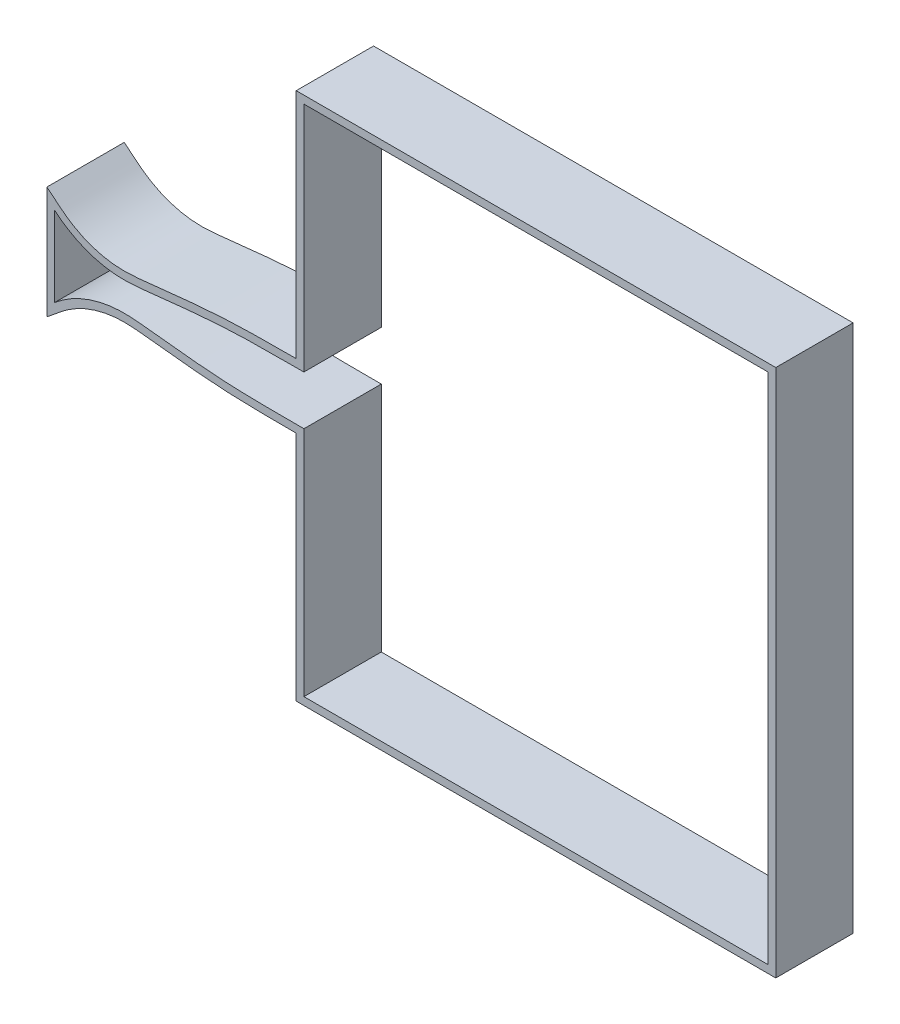
from build123d import *

# Parameters (mm, degrees)
BOSS_EXTRUDE1_DEPTH = 10


with BuildPart() as part:
    # Sketch1 → Boss-Extrude1 (new body)
    with BuildSketch(Plane.XY):
        with BuildLine():
            Line((22.239488, 4.172871951), (22.239488, 34.175))
            Line((22.239488, 34.175), (84.239488, 34.175))
            Line((84.239488, 34.175), (84.239488, -34.175))
            Line((84.239488, -34.175), (22.239488, -34.175))
            Line((22.239488, -34.175), (22.239488, -4.172871951))
            add(Edge.make_bspline(
                [(22.239488, -4.172871951), (20.811936237, -4.16995243), (17.963311559, -4.167994042), (13.651754932, -4.068671657), (9.331479031, -3.767364838), (5.784640978, -3.369979917), (2.95109285, -3.070473951), (0.846895558, -2.84551462), (-1.117705925, -2.848890085), (-3.084740909, -3.177332136), (-4.971804576, -3.798295309), (-6.449840697, -4.553316639), (-7.410297413, -5.193382202), (-7.94471134, -5.593586015), (-8.252225011, -5.847578902), (-8.548354976, -6.089216355), (-8.819451895, -6.310186739), (-9.305605744, -6.706572599), (-9.718285875, -7.043010414), (-9.9943, -7.2680404)],
                knots=[-0.063648949, -0.063648949, -0.063648949, -0.063648949, 0.065536167, 0.194721282, 0.323906398, 0.453091514, 0.517684072, 0.58227663, 0.646869188, 0.711461746, 0.776054304, 0.840646861, 0.87294314, 0.88909128, 0.905239419, 0.913313489, 0.921387559, 0.937535698, 0.969831977, 0.969831977, 0.969831977, 0.969831977], degree=3))
            Line((-9.9943, -7.2680404), (-9.9943, 7.2680404))
            add(Edge.make_bspline(
                [(-9.9943, 7.2680404), (-9.718285875, 7.043010414), (-9.305605744, 6.706572599), (-8.819451895, 6.310186739), (-8.548354976, 6.089216355), (-8.252225011, 5.847578902), (-7.94471134, 5.593586015), (-7.410297413, 5.193382202), (-6.449840697, 4.553316639), (-4.971804576, 3.798295309), (-3.084740909, 3.177332136), (-1.117705925, 2.848890085), (0.846895558, 2.84551462), (2.95109285, 3.070473951), (5.784640978, 3.369979917), (9.331479031, 3.767364838), (13.651754932, 4.068671657), (17.963311559, 4.167994042), (20.811936237, 4.16995243), (22.239488, 4.172871951)],
                knots=[-0.063648949, -0.063648949, -0.063648949, -0.063648949, -0.03135267, -0.015204531, -0.007130461, 0.000943609, 0.017091748, 0.033239888, 0.065536167, 0.130128725, 0.194721282, 0.25931384, 0.323906398, 0.388498956, 0.453091514, 0.58227663, 0.711461746, 0.840646861, 0.969831977, 0.969831977, 0.969831977, 0.969831977], degree=3))
        make_face()
        with BuildLine():
            Line((-8.9943, 5.162528), (-8.9943, -5.162528))
            add(Edge.make_bspline(
                [(-8.9943, -5.162528), (-8.992203206, -5.160818517), (-8.98586262, -5.155649136), (-8.971129638, -5.143403342), (-8.941596507, -5.118788275), (-8.889795396, -5.075674298), (-8.819707257, -5.017872266), (-8.739535444, -4.952719339), (-8.658924661, -4.888049496), (-8.577791761, -4.823999043), (-8.496258263, -4.760453941), (-8.414205967, -4.697584415), (-8.331736552, -4.635254146), (-8.248777214, -4.573563059), (-8.165419061, -4.512434699), (-8.081580077, -4.45196728), (-7.9973532, -4.392059705), (-7.912646922, -4.332839746), (-7.827516389, -4.274244032), (-7.741952356, -4.216312216), (-7.656032011, -4.158921328), (-7.5696025, -4.102309097), (-7.482848419, -4.046222466), (-7.366578831, -3.972380582), (-7.249521601, -3.899846958), (-7.10222116, -3.810815104), (-6.98360377, -3.740946897), (-6.864263465, -3.672349055), (-6.774351679, -3.621638171), (-6.684136735, -3.571491967), (-6.593487596, -3.522132873), (-6.502506407, -3.473416905), (-6.380762357, -3.409328633), (-6.258312716, -3.346634834), (-6.135165576, -3.285356586), (-6.042502537, -3.240030779), (-5.949500015, -3.195440637), (-5.856205076, -3.151484582), (-5.76254452, -3.108366232), (-5.637330863, -3.051619351), (-5.511439039, -2.996407964), (-5.384988859, -2.942495224), (-5.289848788, -2.90280669), (-5.194408906, -2.863895372), (-5.098733929, -2.825565756), (-5.002756597, -2.788053796), (-4.906520294, -2.751229744), (-4.810020655, -2.71512666), (-4.713276293, -2.679705658), (-4.616236394, -2.645096525), (-4.519008245, -2.611100866), (-4.421484056, -2.577920992), (-4.32374684, -2.545422054), (-4.225759333, -2.513688605), (-4.127585288, -2.48259141), (-4.02916043, -2.452366366), (-3.93056407, -2.422738024), (-3.831719131, -2.393979651), (-3.73268439, -2.365861036), (-3.633432171, -2.338510442), (-3.533997518, -2.311878394), (-3.434363987, -2.286066253), (-3.334575625, -2.260904143), (-3.234603794, -2.236500302), (-3.1344442, -2.212891407), (-3.034127127, -2.190005598), (-2.933644312, -2.16786689), (-2.833016004, -2.146456177), (-2.73222849, -2.125841282), (-2.631307918, -2.105959485), (-2.530249774, -2.086820843), (-2.429061322, -2.068396827), (-2.327736643, -2.050800997), (-2.22630246, -2.033892869), (-2.12474757, -2.017804859), (-2.02307448, -2.002439883), (-1.921294105, -1.987809674), (-1.819415258, -1.973964347), (-1.717451354, -1.960910941), (-1.615408345, -1.948587767), (-1.513272589, -1.936985969), (-1.411047623, -1.926204243), (-1.308761012, -1.916125148), (-1.206416776, -1.906838844), (-1.10400139, -1.898348903), (-1.001535686, -1.890570128), (-0.899011185, -1.88360275), (-0.796463235, -1.877341897), (-0.693870688, -1.871896688), (-0.591253692, -1.867155595), (-0.488607835, -1.863214354), (-0.385933935, -1.860064903), (-0.283247852, -1.857623052), (-0.180531822, -1.855997245), (-0.077816037, -1.85508318), (0.024884574, -1.854942505), (0.12755585, -1.855680532), (0.230213339, -1.85705765), (0.332872854, -1.859193557), (0.435517245, -1.862089014), (0.538137151, -1.865625069), (0.640720548, -1.870023623), (0.743276429, -1.874780017), (0.845801317, -1.880432492), (0.948301748, -1.886352868), (1.050773913, -1.892989226), (1.153211127, -1.899969072), (1.255624107, -1.907306406), (1.358002973, -1.915101749), (1.46037415, -1.923173585), (1.562722462, -1.93164289), (1.665059294, -1.940210628), (1.767349607, -1.94923381), (1.869643143, -1.958309398), (1.971911547, -1.967704888), (2.07417101, -1.977234639), (2.176406711, -1.986906275), (2.278616518, -1.996854456), (2.380827933, -2.006795529), (2.483026454, -2.016977436), (2.585234764, -2.02718377), (2.721482878, -2.041004503), (2.857716127, -2.054960241), (2.993925547, -2.069106268), (3.096089226, -2.079745833), (3.198242005, -2.090410655), (3.300388701, -2.101191252), (3.436578964, -2.115600076), (3.572774714, -2.130001449), (3.708958822, -2.144536798), (3.811095708, -2.155417601), (3.913234355, -2.166292493), (4.015367322, -2.17723734), (4.117504518, -2.188153155), (4.219639884, -2.19908919), (4.32177904, -2.210000413), (4.457948535, -2.224653433), (4.594136158, -2.239150992), (4.730303873, -2.253823725), (4.832447905, -2.264706237), (4.934576704, -2.275717192), (5.036719722, -2.286606382), (5.138849282, -2.297610582), (5.240992277, -2.308499985), (5.343121168, -2.319510089), (5.445264527, -2.330395756), (5.547396695, -2.341388952), (5.649520606, -2.352345348), (5.751652944, -2.363336952), (5.853796019, -2.37422839), (5.989982034, -2.388882119), (6.126160723, -2.403490373), (6.262337286, -2.418118778), (6.364473405, -2.429085993), (6.466606851, -2.440067603), (6.568749044, -2.450964159), (6.670878566, -2.461968374), (6.773019049, -2.472870325), (6.875168231, -2.483804949), (6.977302168, -2.494740746), (7.079455082, -2.505609954), (7.18158511, -2.516528009), (7.283743863, -2.527287031), (7.385884966, -2.538174726), (7.488051977, -2.548919623), (7.590218317, -2.559629437), (7.69237632, -2.570377952), (7.794556884, -2.581000171), (7.896731641, -2.59161017), (7.998924778, -2.602119663), (8.101102412, -2.612588839), (8.203290439, -2.623038473), (8.305481566, -2.633389343), (8.407703269, -2.643642556), (8.509916144, -2.653898932), (8.612153553, -2.66397771), (8.714382571, -2.674058828), (8.816629453, -2.68403213), (8.918872297, -2.693948187), (9.021120802, -2.703709794), (9.157469743, -2.716646149), (9.293839908, -2.729396843), (9.430224982, -2.742006878), (9.532524926, -2.751336831), (9.634828516, -2.76051644), (9.737139421, -2.769661208), (9.839470537, -2.778636437), (9.941809604, -2.787567275), (10.044167889, -2.796338059), (10.146504315, -2.805082209), (10.248867356, -2.813576388), (10.351228456, -2.822134759), (10.453617082, -2.830429571), (10.556010143, -2.838713585), (10.658407431, -2.846836333), (10.760816939, -2.854853891), (10.897375037, -2.865350629), (11.03392921, -2.875736931), (11.204661852, -2.888229806), (11.341260343, -2.898115843), (11.477878204, -2.90777299), (11.580360741, -2.914810964), (11.682836949, -2.921817544), (11.78533197, -2.928652095), (11.887819832, -2.935466787), (11.990316563, -2.94204092), (12.09281819, -2.948615295), (12.19534351, -2.954934101), (12.297859492, -2.961287536), (12.400391171, -2.967506261), (12.502928266, -2.973509673), (12.605473012, -2.979491982), (12.708008371, -2.985304473), (12.810553712, -2.991072136), (12.913114846, -2.996699097), (13.015690838, -3.002187265), (13.118263381, -3.007630968), (13.220839727, -3.012905925), (13.32341104, -3.018156681), (13.425988594, -3.023180174), (13.528576417, -3.028154709), (13.63117684, -3.033056896), (13.733780089, -3.037802969), (13.836380399, -3.04250297), (13.938982519, -3.047062038), (14.041599171, -3.051482873), (14.144213518, -3.055855903), (14.24683007, -3.060072986), (14.349459564, -3.064218205), (14.452086314, -3.068317114), (14.554732764, -3.072171988), (14.657359343, -3.076071303), (14.760003774, -3.079785757), (14.862645273, -3.083462321), (14.965289506, -3.086974504), (15.067931109, -3.090444613), (15.170575092, -3.093757313), (15.273231786, -3.097002371), (15.375887674, -3.100178951), (15.512776084, -3.104214633), (15.649664909, -3.10811291), (15.7865557, -3.111828824), (15.889225147, -3.114562638), (15.991897127, -3.117114578), (16.094565938, -3.119696886), (16.197237157, -3.122099611), (16.368369316, -3.126011401), (16.539505107, -3.129629916), (16.710643146, -3.132993286), (16.813327367, -3.134909125), (16.916010888, -3.136812133), (17.01869497, -3.138616817), (17.121378943, -3.140345931), (17.224077098, -3.141973593), (17.326773983, -3.143591685), (17.429458061, -3.145109384), (17.532142454, -3.146533577), (17.634826033, -3.14794941), (17.737524167, -3.149242905), (17.840221427, -3.150536973), (17.942919477, -3.151711173), (18.045617095, -3.152866294), (18.148314477, -3.153971656), (18.251011866, -3.155055051), (18.353696182, -3.15602401), (18.490612546, -3.157290878), (18.627528905, -3.158469505), (18.764459206, -3.159556644), (18.867156649, -3.160356142), (18.969854698, -3.161028776), (19.072552362, -3.161726737), (19.209481715, -3.162691467), (19.346412631, -3.163421421), (19.483342877, -3.164204819), (19.586040553, -3.164739449), (19.68873836, -3.165217373), (19.791435544, -3.165729065), (19.894133359, -3.166162355), (19.996830901, -3.166629521), (20.099528582, -3.167039558), (20.202226341, -3.167398238), (20.304924008, -3.167767497), (20.407621579, -3.168151774), (20.510319344, -3.168465399), (20.613017007, -3.168794635), (20.715714589, -3.169138059), (20.818412346, -3.169409121), (20.921109659, -3.169703461), (21.023807347, -3.169983031), (21.126504921, -3.170292422), (21.229202752, -3.170503282), (21.331900254, -3.170826446), (21.434598014, -3.171050939), (21.537295659, -3.171305798), (21.639993346, -3.171543865), (21.742690599, -3.171812747), (21.845388408, -3.171981144), (21.948085924, -3.172268683), (22.050783743, -3.172432124), (22.153481257, -3.172720817), (22.256179075, -3.17288461), (22.358876594, -3.173170742), (22.461574404, -3.173338415), (22.598504217, -3.173710663), (22.735434781, -3.173907526), (22.872364603, -3.174276122), (22.975062342, -3.174461833), (23.077759997, -3.174672549), (23.165902008, -3.174845422), (23.219811334, -3.174958666), (23.239488, -3.175)],
                knots=[0, 0, 0, 0, 0.000245345, 0.000741909, 0.001737385, 0.003732016, 0.006853962, 0.009976299, 0.013100827, 0.016226212, 0.019350626, 0.022475447, 0.025600591, 0.028725503, 0.031851099, 0.03497502, 0.038099945, 0.041224576, 0.044348076, 0.047472353, 0.050595529, 0.053718436, 0.056842274, 0.059964148, 0.066209496, 0.069330571, 0.075573132, 0.078693888, 0.081813908, 0.084934604, 0.088054319, 0.09117441, 0.094293931, 0.100531463, 0.103649786, 0.106768227, 0.109886396, 0.113003357, 0.116121039, 0.119237205, 0.125470549, 0.128587392, 0.131703578, 0.134819279, 0.137934423, 0.141050596, 0.14416449, 0.147279058, 0.150394431, 0.153507644, 0.156622415, 0.159735357, 0.162849813, 0.165963219, 0.169076092, 0.172189034, 0.175300614, 0.178412641, 0.181524813, 0.184636936, 0.187749175, 0.190860221, 0.193970852, 0.197082113, 0.200192715, 0.203303099, 0.206413463, 0.209523908, 0.212633207, 0.215742963, 0.218852161, 0.221960931, 0.225070453, 0.228178671, 0.231286771, 0.234395153, 0.237503956, 0.24061195, 0.243719311, 0.246826374, 0.249933327, 0.253041408, 0.256148422, 0.25925448, 0.262360967, 0.265468185, 0.268573678, 0.271680207, 0.274785421, 0.277890736, 0.280996323, 0.284101063, 0.287206466, 0.290311401, 0.293417389, 0.296521989, 0.299625147, 0.302728733, 0.305832703, 0.308937189, 0.312041127, 0.315144658, 0.318248907, 0.32135178, 0.324456627, 0.327560065, 0.330664322, 0.333768125, 0.336871605, 0.33997585, 0.343080895, 0.346185221, 0.349289162, 0.352393541, 0.35549859, 0.358602861, 0.361707569, 0.364811664, 0.367915999, 0.371020789, 0.374125859, 0.377231301, 0.383440444, 0.386545415, 0.38965048, 0.392755708, 0.395859931, 0.398965545, 0.405175645, 0.408280291, 0.411386139, 0.414490784, 0.417595531, 0.420701541, 0.423806288, 0.426911065, 0.430017177, 0.436226701, 0.43933161, 0.44243762, 0.445542499, 0.448647276, 0.451753391, 0.454858168, 0.457963047, 0.461069057, 0.464173936, 0.467278845, 0.470383755, 0.473489734, 0.476594643, 0.482805664, 0.485910543, 0.489015456, 0.492121567, 0.495226345, 0.498331224, 0.501437233, 0.504542011, 0.50764799, 0.510752636, 0.513858484, 0.516962867, 0.520068581, 0.523174067, 0.526279424, 0.529384747, 0.532489846, 0.535596046, 0.538700732, 0.541806551, 0.544910981, 0.548016424, 0.551121614, 0.554227917, 0.557332588, 0.560438399, 0.563543967, 0.566649296, 0.569754239, 0.572858976, 0.57907022, 0.582175495, 0.585280401, 0.588386234, 0.591490613, 0.594595897, 0.597702199, 0.600806946, 0.603912717, 0.607016833, 0.610122085, 0.613228163, 0.616332805, 0.619438384, 0.622543673, 0.625648672, 0.631859276, 0.634963436, 0.641173692, 0.644279701, 0.647384127, 0.650489653, 0.653594896, 0.656699974, 0.659804728, 0.662909353, 0.666014875, 0.669120318, 0.672224298, 0.675330485, 0.678435261, 0.681539823, 0.684644274, 0.687749727, 0.690855008, 0.693960127, 0.697065051, 0.700169879, 0.703274428, 0.706378885, 0.709484433, 0.712589804, 0.715693853, 0.718798943, 0.721903899, 0.72500872, 0.728113414, 0.731217978, 0.73432371, 0.737427981, 0.740533474, 0.74363756, 0.746742826, 0.749847931, 0.752951743, 0.756056641, 0.75916149, 0.76226626, 0.765370889, 0.771581199, 0.774685645, 0.777789996, 0.78089552, 0.783999773, 0.787103905, 0.79020925, 0.799523688, 0.802627553, 0.805732639, 0.808837672, 0.811941451, 0.815046427, 0.818151331, 0.821256247, 0.824361094, 0.827464697, 0.830569522, 0.833674283, 0.83677906, 0.839883806, 0.842988509, 0.846093228, 0.849197903, 0.852302583, 0.855406013, 0.861615288, 0.864719895, 0.867824522, 0.870929132, 0.874033711, 0.87713832, 0.88334747, 0.886452056, 0.889556636, 0.892661179, 0.895765753, 0.89887029, 0.901974858, 0.90507942, 0.908183948, 0.911288506, 0.914393064, 0.917497587, 0.92060214, 0.923706694, 0.926811214, 0.929915763, 0.933020283, 0.936124833, 0.93922938, 0.942333899, 0.945438446, 0.948542992, 0.951647509, 0.954752055, 0.957856569, 0.960961116, 0.96406566, 0.967170176, 0.97027472, 0.973379266, 0.97648378, 0.979588327, 0.985797384, 0.988901931, 0.992006445, 0.995110988, 0.998215532, 1, 1, 1, 1], degree=3))
            Line((23.239488, -3.175), (23.239488, -33.175))
            Line((23.239488, -33.175), (83.239488, -33.175))
            Line((83.239488, -33.175), (83.239488, 33.175))
            Line((83.239488, 33.175), (23.239488, 33.175))
            Line((23.239488, 33.175), (23.239488, 3.175))
            add(Edge.make_bspline(
                [(-8.9943, 5.162528), (-8.992203206, 5.160818517), (-8.98586262, 5.155649136), (-8.971129638, 5.143403342), (-8.941596507, 5.118788275), (-8.889795396, 5.075674298), (-8.819707257, 5.017872266), (-8.739535444, 4.952719339), (-8.658924661, 4.888049496), (-8.577791761, 4.823999043), (-8.496258263, 4.760453941), (-8.414205967, 4.697584415), (-8.331736552, 4.635254146), (-8.248777214, 4.573563059), (-8.165419061, 4.512434699), (-8.081580077, 4.45196728), (-7.9973532, 4.392059705), (-7.912646922, 4.332839746), (-7.827516389, 4.274244032), (-7.741952356, 4.216312216), (-7.656032011, 4.158921328), (-7.5696025, 4.102309097), (-7.482848419, 4.046222466), (-7.366578831, 3.972380582), (-7.249521601, 3.899846958), (-7.10222116, 3.810815104), (-6.98360377, 3.740946897), (-6.864263465, 3.672349055), (-6.774351679, 3.621638171), (-6.684136735, 3.571491967), (-6.593487596, 3.522132873), (-6.502506407, 3.473416905), (-6.380762357, 3.409328633), (-6.258312716, 3.346634834), (-6.135165576, 3.285356586), (-6.042502537, 3.240030779), (-5.949500015, 3.195440637), (-5.856205076, 3.151484582), (-5.76254452, 3.108366232), (-5.637330863, 3.051619351), (-5.511439039, 2.996407964), (-5.384988859, 2.942495224), (-5.289848788, 2.90280669), (-5.194408906, 2.863895372), (-5.098733929, 2.825565756), (-5.002756597, 2.788053796), (-4.906520294, 2.751229744), (-4.810020655, 2.71512666), (-4.713276293, 2.679705658), (-4.616236394, 2.645096525), (-4.519008245, 2.611100866), (-4.421484056, 2.577920992), (-4.32374684, 2.545422054), (-4.225759333, 2.513688605), (-4.127585288, 2.48259141), (-4.02916043, 2.452366366), (-3.93056407, 2.422738024), (-3.831719131, 2.393979651), (-3.73268439, 2.365861036), (-3.633432171, 2.338510442), (-3.533997518, 2.311878394), (-3.434363987, 2.286066253), (-3.334575625, 2.260904143), (-3.234603794, 2.236500302), (-3.1344442, 2.212891407), (-3.034127127, 2.190005598), (-2.933644312, 2.16786689), (-2.833016004, 2.146456177), (-2.73222849, 2.125841282), (-2.631307918, 2.105959485), (-2.530249774, 2.086820843), (-2.429061322, 2.068396827), (-2.327736643, 2.050800997), (-2.22630246, 2.033892869), (-2.12474757, 2.017804859), (-2.02307448, 2.002439883), (-1.921294105, 1.987809674), (-1.819415258, 1.973964347), (-1.717451354, 1.960910941), (-1.615408345, 1.948587767), (-1.513272589, 1.936985969), (-1.411047623, 1.926204243), (-1.308761012, 1.916125148), (-1.206416776, 1.906838844), (-1.10400139, 1.898348903), (-1.001535686, 1.890570128), (-0.899011185, 1.88360275), (-0.796463235, 1.877341897), (-0.693870688, 1.871896688), (-0.591253692, 1.867155595), (-0.488607835, 1.863214354), (-0.385933935, 1.860064903), (-0.283247852, 1.857623052), (-0.180531822, 1.855997245), (-0.077816037, 1.85508318), (0.024884574, 1.854942505), (0.12755585, 1.855680532), (0.230213339, 1.85705765), (0.332872854, 1.859193557), (0.435517245, 1.862089014), (0.538137151, 1.865625069), (0.640720548, 1.870023623), (0.743276429, 1.874780017), (0.845801317, 1.880432492), (0.948301748, 1.886352868), (1.050773913, 1.892989226), (1.153211127, 1.899969072), (1.255624107, 1.907306406), (1.358002973, 1.915101749), (1.46037415, 1.923173585), (1.562722462, 1.93164289), (1.665059294, 1.940210628), (1.767349607, 1.94923381), (1.869643143, 1.958309398), (1.971911547, 1.967704888), (2.07417101, 1.977234639), (2.176406711, 1.986906275), (2.278616518, 1.996854456), (2.380827933, 2.006795529), (2.483026454, 2.016977436), (2.585234764, 2.02718377), (2.721482878, 2.041004503), (2.857716127, 2.054960241), (2.993925547, 2.069106268), (3.096089226, 2.079745833), (3.198242005, 2.090410655), (3.300388701, 2.101191252), (3.436578964, 2.115600076), (3.572774714, 2.130001449), (3.708958822, 2.144536798), (3.811095708, 2.155417601), (3.913234355, 2.166292493), (4.015367322, 2.17723734), (4.117504518, 2.188153155), (4.219639884, 2.19908919), (4.32177904, 2.210000413), (4.457948535, 2.224653433), (4.594136158, 2.239150992), (4.730303873, 2.253823725), (4.832447905, 2.264706237), (4.934576704, 2.275717192), (5.036719722, 2.286606382), (5.138849282, 2.297610582), (5.240992277, 2.308499985), (5.343121168, 2.319510089), (5.445264527, 2.330395756), (5.547396695, 2.341388952), (5.649520606, 2.352345348), (5.751652944, 2.363336952), (5.853796019, 2.37422839), (5.989982034, 2.388882119), (6.126160723, 2.403490373), (6.262337286, 2.418118778), (6.364473405, 2.429085993), (6.466606851, 2.440067603), (6.568749044, 2.450964159), (6.670878566, 2.461968374), (6.773019049, 2.472870325), (6.875168231, 2.483804949), (6.977302168, 2.494740746), (7.079455082, 2.505609954), (7.18158511, 2.516528009), (7.283743863, 2.527287031), (7.385884966, 2.538174726), (7.488051977, 2.548919623), (7.590218317, 2.559629437), (7.69237632, 2.570377952), (7.794556884, 2.581000171), (7.896731641, 2.59161017), (7.998924778, 2.602119663), (8.101102412, 2.612588839), (8.203290439, 2.623038473), (8.305481566, 2.633389343), (8.407703269, 2.643642556), (8.509916144, 2.653898932), (8.612153553, 2.66397771), (8.714382571, 2.674058828), (8.816629453, 2.68403213), (8.918872297, 2.693948187), (9.021120802, 2.703709794), (9.157469743, 2.716646149), (9.293839908, 2.729396843), (9.430224982, 2.742006878), (9.532524926, 2.751336831), (9.634828516, 2.76051644), (9.737139421, 2.769661208), (9.839470537, 2.778636437), (9.941809604, 2.787567275), (10.044167889, 2.796338059), (10.146504315, 2.805082209), (10.248867356, 2.813576388), (10.351228456, 2.822134759), (10.453617082, 2.830429571), (10.556010143, 2.838713585), (10.658407431, 2.846836333), (10.760816939, 2.854853891), (10.897375037, 2.865350629), (11.03392921, 2.875736931), (11.204661852, 2.888229806), (11.341260343, 2.898115843), (11.477878204, 2.90777299), (11.580360741, 2.914810964), (11.682836949, 2.921817544), (11.78533197, 2.928652095), (11.887819832, 2.935466787), (11.990316563, 2.94204092), (12.09281819, 2.948615295), (12.19534351, 2.954934101), (12.297859492, 2.961287536), (12.400391171, 2.967506261), (12.502928266, 2.973509673), (12.605473012, 2.979491982), (12.708008371, 2.985304473), (12.810553712, 2.991072136), (12.913114846, 2.996699097), (13.015690838, 3.002187265), (13.118263381, 3.007630968), (13.220839727, 3.012905925), (13.32341104, 3.018156681), (13.425988594, 3.023180174), (13.528576417, 3.028154709), (13.63117684, 3.033056896), (13.733780089, 3.037802969), (13.836380399, 3.04250297), (13.938982519, 3.047062038), (14.041599171, 3.051482873), (14.144213518, 3.055855903), (14.24683007, 3.060072986), (14.349459564, 3.064218205), (14.452086314, 3.068317114), (14.554732764, 3.072171988), (14.657359343, 3.076071303), (14.760003774, 3.079785757), (14.862645273, 3.083462321), (14.965289506, 3.086974504), (15.067931109, 3.090444613), (15.170575092, 3.093757313), (15.273231786, 3.097002371), (15.375887674, 3.100178951), (15.512776084, 3.104214633), (15.649664909, 3.10811291), (15.7865557, 3.111828824), (15.889225147, 3.114562638), (15.991897127, 3.117114578), (16.094565938, 3.119696886), (16.197237157, 3.122099611), (16.368369316, 3.126011401), (16.539505107, 3.129629916), (16.710643146, 3.132993286), (16.813327367, 3.134909125), (16.916010888, 3.136812133), (17.01869497, 3.138616817), (17.121378943, 3.140345931), (17.224077098, 3.141973593), (17.326773983, 3.143591685), (17.429458061, 3.145109384), (17.532142454, 3.146533577), (17.634826033, 3.14794941), (17.737524167, 3.149242905), (17.840221427, 3.150536973), (17.942919477, 3.151711173), (18.045617095, 3.152866294), (18.148314477, 3.153971656), (18.251011866, 3.155055051), (18.353696182, 3.15602401), (18.490612546, 3.157290878), (18.627528905, 3.158469505), (18.764459206, 3.159556644), (18.867156649, 3.160356142), (18.969854698, 3.161028776), (19.072552362, 3.161726737), (19.209481715, 3.162691467), (19.346412631, 3.163421421), (19.483342877, 3.164204819), (19.586040553, 3.164739449), (19.68873836, 3.165217373), (19.791435544, 3.165729065), (19.894133359, 3.166162355), (19.996830901, 3.166629521), (20.099528582, 3.167039558), (20.202226341, 3.167398238), (20.304924008, 3.167767497), (20.407621579, 3.168151774), (20.510319344, 3.168465399), (20.613017007, 3.168794635), (20.715714589, 3.169138059), (20.818412346, 3.169409121), (20.921109659, 3.169703461), (21.023807347, 3.169983031), (21.126504921, 3.170292422), (21.229202752, 3.170503282), (21.331900254, 3.170826446), (21.434598014, 3.171050939), (21.537295659, 3.171305798), (21.639993346, 3.171543865), (21.742690599, 3.171812747), (21.845388408, 3.171981144), (21.948085924, 3.172268683), (22.050783743, 3.172432124), (22.153481257, 3.172720817), (22.256179075, 3.17288461), (22.358876594, 3.173170742), (22.461574404, 3.173338415), (22.598504217, 3.173710663), (22.735434781, 3.173907526), (22.872364603, 3.174276122), (22.975062342, 3.174461833), (23.077759997, 3.174672549), (23.165902008, 3.174845422), (23.219811334, 3.174958666), (23.239488, 3.175)],
                knots=[0, 0, 0, 0, 0.000245345, 0.000741909, 0.001737385, 0.003732016, 0.006853962, 0.009976299, 0.013100827, 0.016226212, 0.019350626, 0.022475447, 0.025600591, 0.028725503, 0.031851099, 0.03497502, 0.038099945, 0.041224576, 0.044348076, 0.047472353, 0.050595529, 0.053718436, 0.056842274, 0.059964148, 0.066209496, 0.069330571, 0.075573132, 0.078693888, 0.081813908, 0.084934604, 0.088054319, 0.09117441, 0.094293931, 0.100531463, 0.103649786, 0.106768227, 0.109886396, 0.113003357, 0.116121039, 0.119237205, 0.125470549, 0.128587392, 0.131703578, 0.134819279, 0.137934423, 0.141050596, 0.14416449, 0.147279058, 0.150394431, 0.153507644, 0.156622415, 0.159735357, 0.162849813, 0.165963219, 0.169076092, 0.172189034, 0.175300614, 0.178412641, 0.181524813, 0.184636936, 0.187749175, 0.190860221, 0.193970852, 0.197082113, 0.200192715, 0.203303099, 0.206413463, 0.209523908, 0.212633207, 0.215742963, 0.218852161, 0.221960931, 0.225070453, 0.228178671, 0.231286771, 0.234395153, 0.237503956, 0.24061195, 0.243719311, 0.246826374, 0.249933327, 0.253041408, 0.256148422, 0.25925448, 0.262360967, 0.265468185, 0.268573678, 0.271680207, 0.274785421, 0.277890736, 0.280996323, 0.284101063, 0.287206466, 0.290311401, 0.293417389, 0.296521989, 0.299625147, 0.302728733, 0.305832703, 0.308937189, 0.312041127, 0.315144658, 0.318248907, 0.32135178, 0.324456627, 0.327560065, 0.330664322, 0.333768125, 0.336871605, 0.33997585, 0.343080895, 0.346185221, 0.349289162, 0.352393541, 0.35549859, 0.358602861, 0.361707569, 0.364811664, 0.367915999, 0.371020789, 0.374125859, 0.377231301, 0.383440444, 0.386545415, 0.38965048, 0.392755708, 0.395859931, 0.398965545, 0.405175645, 0.408280291, 0.411386139, 0.414490784, 0.417595531, 0.420701541, 0.423806288, 0.426911065, 0.430017177, 0.436226701, 0.43933161, 0.44243762, 0.445542499, 0.448647276, 0.451753391, 0.454858168, 0.457963047, 0.461069057, 0.464173936, 0.467278845, 0.470383755, 0.473489734, 0.476594643, 0.482805664, 0.485910543, 0.489015456, 0.492121567, 0.495226345, 0.498331224, 0.501437233, 0.504542011, 0.50764799, 0.510752636, 0.513858484, 0.516962867, 0.520068581, 0.523174067, 0.526279424, 0.529384747, 0.532489846, 0.535596046, 0.538700732, 0.541806551, 0.544910981, 0.548016424, 0.551121614, 0.554227917, 0.557332588, 0.560438399, 0.563543967, 0.566649296, 0.569754239, 0.572858976, 0.57907022, 0.582175495, 0.585280401, 0.588386234, 0.591490613, 0.594595897, 0.597702199, 0.600806946, 0.603912717, 0.607016833, 0.610122085, 0.613228163, 0.616332805, 0.619438384, 0.622543673, 0.625648672, 0.631859276, 0.634963436, 0.641173692, 0.644279701, 0.647384127, 0.650489653, 0.653594896, 0.656699974, 0.659804728, 0.662909353, 0.666014875, 0.669120318, 0.672224298, 0.675330485, 0.678435261, 0.681539823, 0.684644274, 0.687749727, 0.690855008, 0.693960127, 0.697065051, 0.700169879, 0.703274428, 0.706378885, 0.709484433, 0.712589804, 0.715693853, 0.718798943, 0.721903899, 0.72500872, 0.728113414, 0.731217978, 0.73432371, 0.737427981, 0.740533474, 0.74363756, 0.746742826, 0.749847931, 0.752951743, 0.756056641, 0.75916149, 0.76226626, 0.765370889, 0.771581199, 0.774685645, 0.777789996, 0.78089552, 0.783999773, 0.787103905, 0.79020925, 0.799523688, 0.802627553, 0.805732639, 0.808837672, 0.811941451, 0.815046427, 0.818151331, 0.821256247, 0.824361094, 0.827464697, 0.830569522, 0.833674283, 0.83677906, 0.839883806, 0.842988509, 0.846093228, 0.849197903, 0.852302583, 0.855406013, 0.861615288, 0.864719895, 0.867824522, 0.870929132, 0.874033711, 0.87713832, 0.88334747, 0.886452056, 0.889556636, 0.892661179, 0.895765753, 0.89887029, 0.901974858, 0.90507942, 0.908183948, 0.911288506, 0.914393064, 0.917497587, 0.92060214, 0.923706694, 0.926811214, 0.929915763, 0.933020283, 0.936124833, 0.93922938, 0.942333899, 0.945438446, 0.948542992, 0.951647509, 0.954752055, 0.957856569, 0.960961116, 0.96406566, 0.967170176, 0.97027472, 0.973379266, 0.97648378, 0.979588327, 0.985797384, 0.988901931, 0.992006445, 0.995110988, 0.998215532, 1, 1, 1, 1], degree=3))
        make_face(mode=Mode.SUBTRACT)
    extrude(amount=BOSS_EXTRUDE1_DEPTH)


solid = part.part
